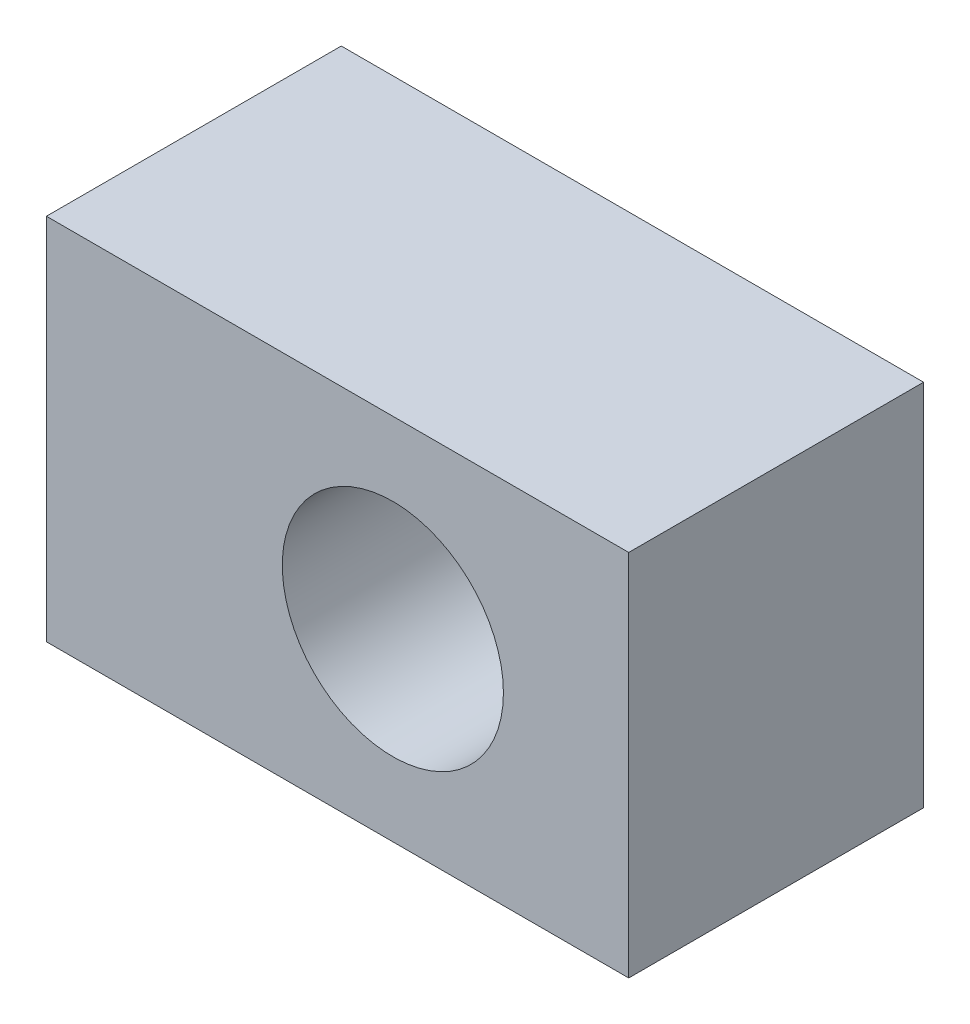
from build123d import *

# Parameters (mm, degrees)
SKETCH1_W           = 79
SKETCH1_H           = 50
SKETCH1_R           = 15
BOSS_EXTRUDE1_DEPTH = 40


with BuildPart() as part:
    # Sketch1 → Boss-Extrude1 (new body)
    with BuildSketch(Plane.XY):
        with Locations((39.5, 25)):
            Rectangle(SKETCH1_W, SKETCH1_H)
        with Locations((47, 25)):
            Circle(SKETCH1_R, mode=Mode.SUBTRACT)
    extrude(amount=BOSS_EXTRUDE1_DEPTH)


solid = part.part
